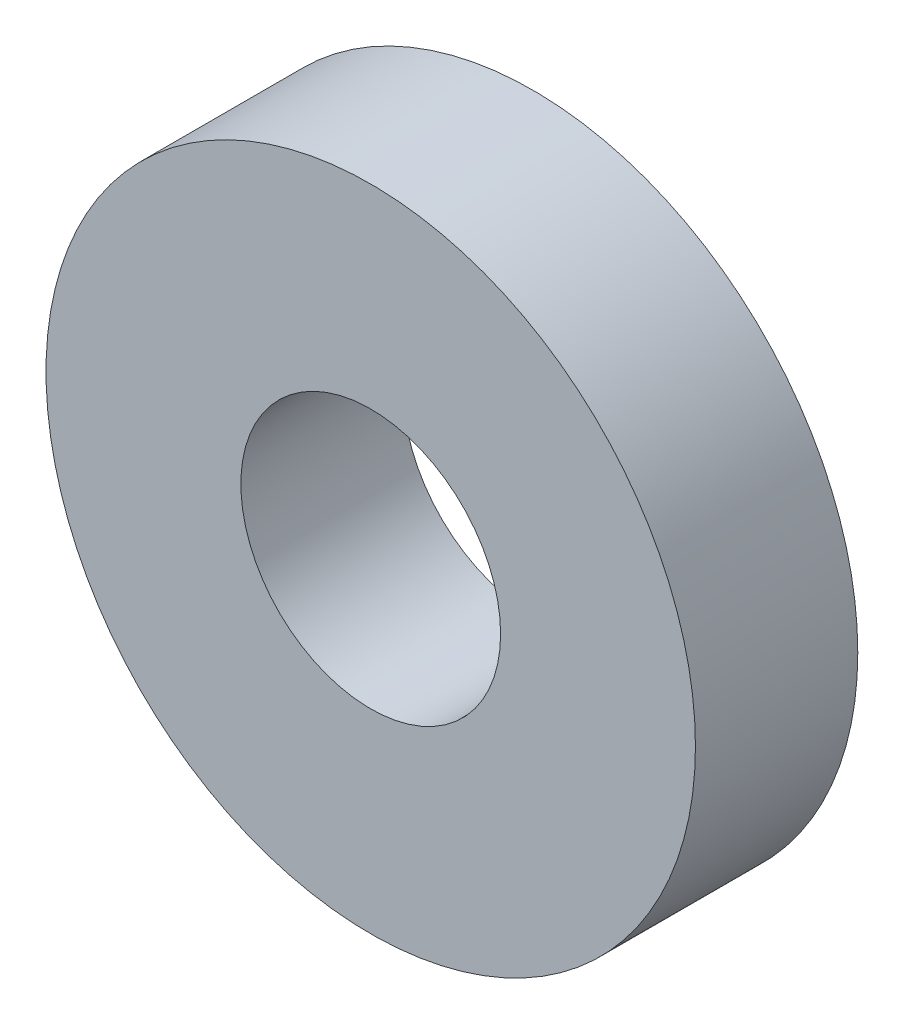
from build123d import *

# Parameters (mm, degrees)
EXTRUDE1_DEPTH      = 1
EXTRUDE1_DEPTH_BACK = 1
SKETCH1_R           = 4
SKETCH1_R_2         = 1.6


with BuildPart() as part:
    # Sketch1 → Extrude1 (new, two sides: drawn at the far end of the back side and taken through both)
    with BuildSketch(Plane.XY.offset(-EXTRUDE1_DEPTH_BACK)):
        Circle(SKETCH1_R)
        Circle(SKETCH1_R_2, mode=Mode.SUBTRACT)
    extrude(amount=EXTRUDE1_DEPTH + EXTRUDE1_DEPTH_BACK)


solid = part.part
